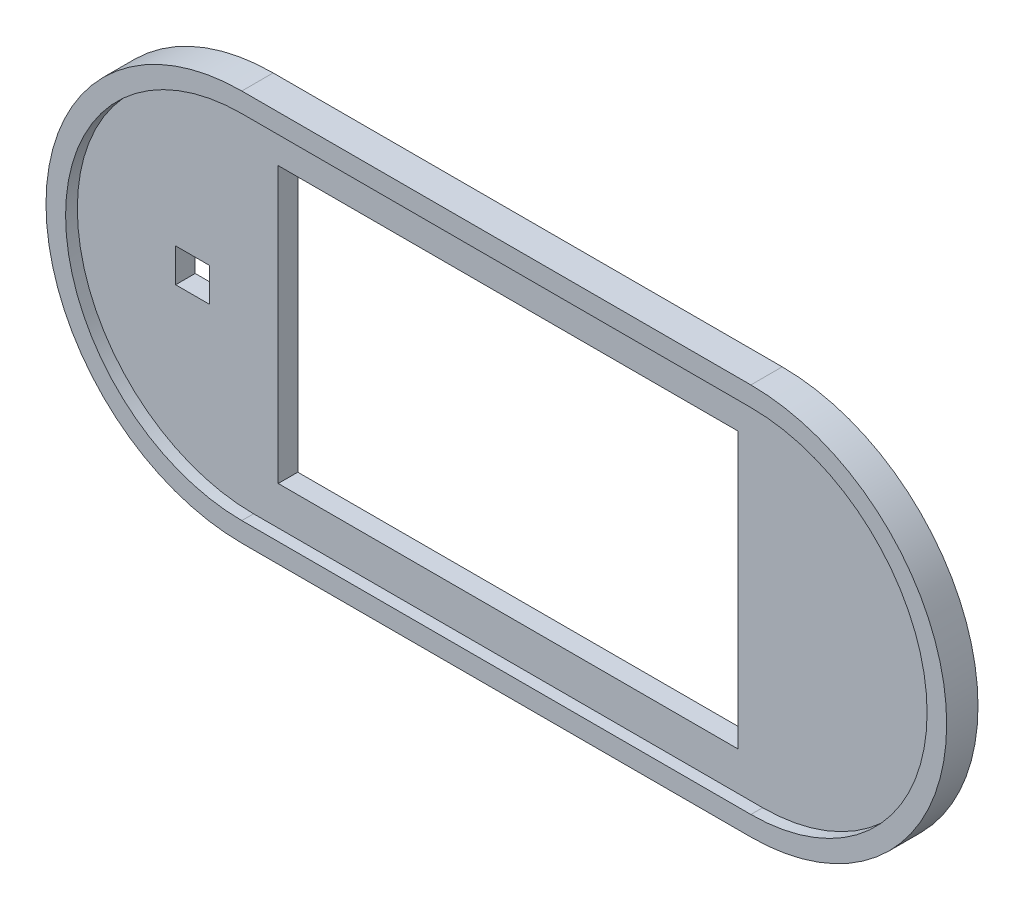
from build123d import *

# Parameters (mm, degrees)
BOSS_EXTRUDE1_DEPTH = 8
SHELL1_T            = -5
SKETCH2_W           = 117.4
SKETCH2_H           = 70.3
SKETCH2_W_2         = 8.6
SKETCH2_H_2         = 8.6
CUT_EXTRUDE1_DEPTH  = 5


with BuildPart() as part:
    # Sketch1 → Boss-Extrude1 (new body)
    with BuildSketch(Plane.XY):
        with BuildLine():
            Line((0, 0), (-130, 0))
            ThreePointArc((-130, 0), (-180, -50), (-130, -100))
            Line((-130, -100), (0, -100))
            ThreePointArc((0, -100), (50, -50), (0, 0))
        make_face()
    extrude(amount=BOSS_EXTRUDE1_DEPTH)

    # Shell1
    shell1_openings = [part.faces().sort_by_distance(p)[0] for p in [
        (-65, -50, 8),
    ]]
    offset(amount=SHELL1_T, openings=shell1_openings, kind=Kind.INTERSECTION)

    # Sketch2 → Cut-Extrude1 (cut)
    with BuildSketch(Plane(origin=(0, 0, 0), x_dir=(-1, 0, 0), z_dir=(0, 0, -1))):
        with Locations((65, -50)):
            Rectangle(SKETCH2_W, SKETCH2_H)
        with Locations((145.596085379, -50)):
            Rectangle(SKETCH2_W_2, SKETCH2_H_2)
    extrude(amount=-CUT_EXTRUDE1_DEPTH, mode=Mode.SUBTRACT)


solid = part.part
